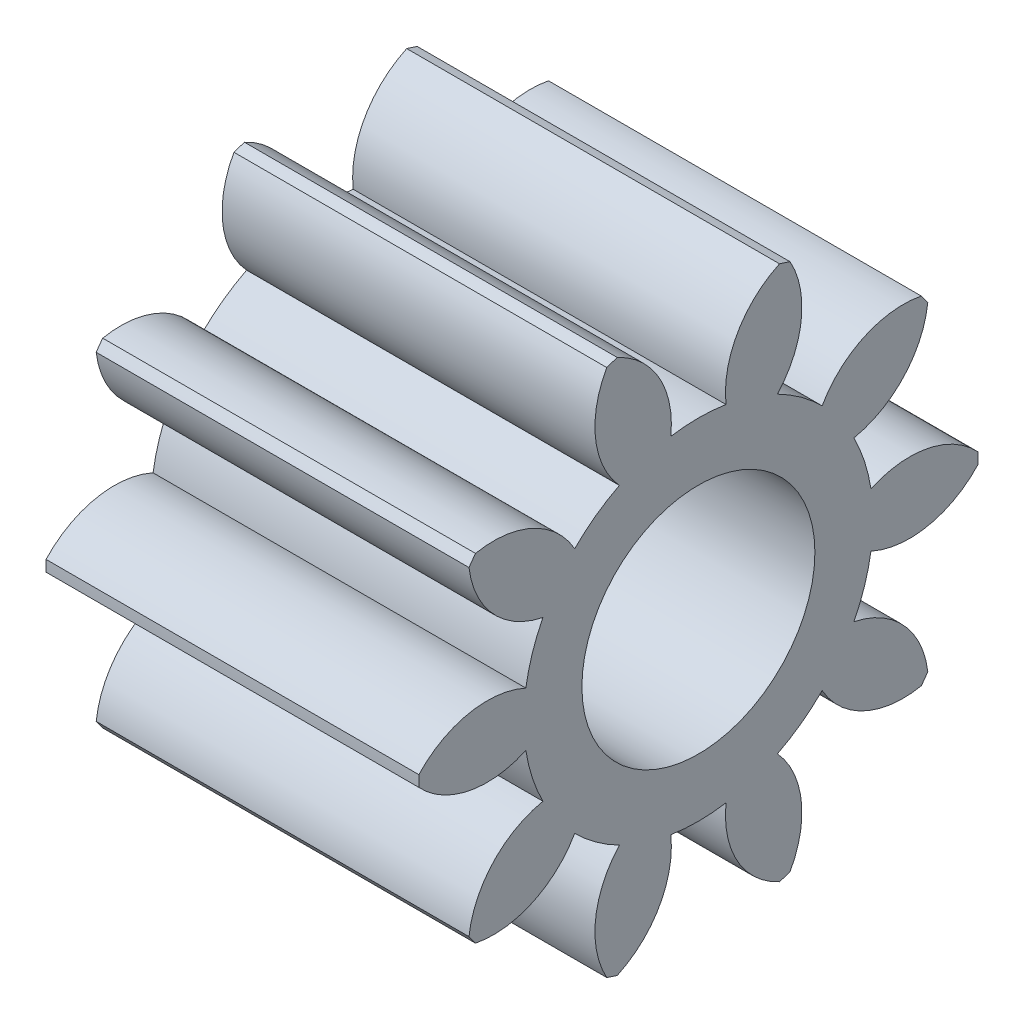
from build123d import *

# Parameters (mm, degrees)
BASPROSKE_W     = 4
BASPROSKE_H     = 3
TOOTHCUT_DEPTH  = 6.830951895
TEETHCUTS_COUNT = 10
TEETHCUTS_ANGLE = 324
BORSKE_R        = 1.25
BORE_DEPTH      = 50.0000508


with BuildPart() as part:
    # BasProSke → Base-Revolve (revolve)
    with BuildSketch(Plane(origin=(0, 0, 0), x_dir=(1, 0, 0), z_dir=(0, 1, 0)), mode=Mode.PRIVATE) as base_revolve_sk:
        with Locations((2, 1.5)):
            Rectangle(BASPROSKE_W, BASPROSKE_H)
    revolve(base_revolve_sk.sketch.rotate(Axis((-10, 0, 0), (1, 0, 0)), 180), axis=Axis((-10, 0, 0), (1, 0, 0)))

    # TooCutSke → ToothCut (cut, through all)
    with BuildSketch(Plane(origin=(0, 0, 0), x_dir=(0, 0, -1), z_dir=(1, 0, 0))):
        with BuildLine():
            ThreePointArc((0.296449938, 1.850403587), (0, 1.874), (-0.296449938, 1.850403587))
            ThreePointArc((-0.296449938, 1.850403587), (-0.428089565, 2.470295585), (-0.905889751, 2.886591228))
            ThreePointArc((-0.905889751, 2.886591228), (0, 3.0254), (0.905889751, 2.886591228))
            ThreePointArc((0.905889751, 2.886591228), (0.428089565, 2.470295585), (0.296449938, 1.850403587))
        make_face()
    toothcut = extrude(amount=TOOTHCUT_DEPTH, mode=Mode.SUBTRACT)

    # TeethCuts: ToothCut ×10 about axis
    teethcuts_axis = Axis((-10, 0, 0), (1, 0, 0))
    for i in range(1, TEETHCUTS_COUNT):
        add(toothcut.rotate(teethcuts_axis, i * TEETHCUTS_ANGLE / (TEETHCUTS_COUNT - 1)), mode=Mode.SUBTRACT)

    # BorSke → Bore (cut, symmetric)
    with BuildSketch(Plane(origin=(0, 0, 0), x_dir=(0, 0, -1), z_dir=(1, 0, 0))):
        with Locations(Location((0, 0, 0), (0, 0, 180))):
            Circle(BORSKE_R)
    extrude(amount=BORE_DEPTH, both=True, mode=Mode.SUBTRACT)


solid = part.part
